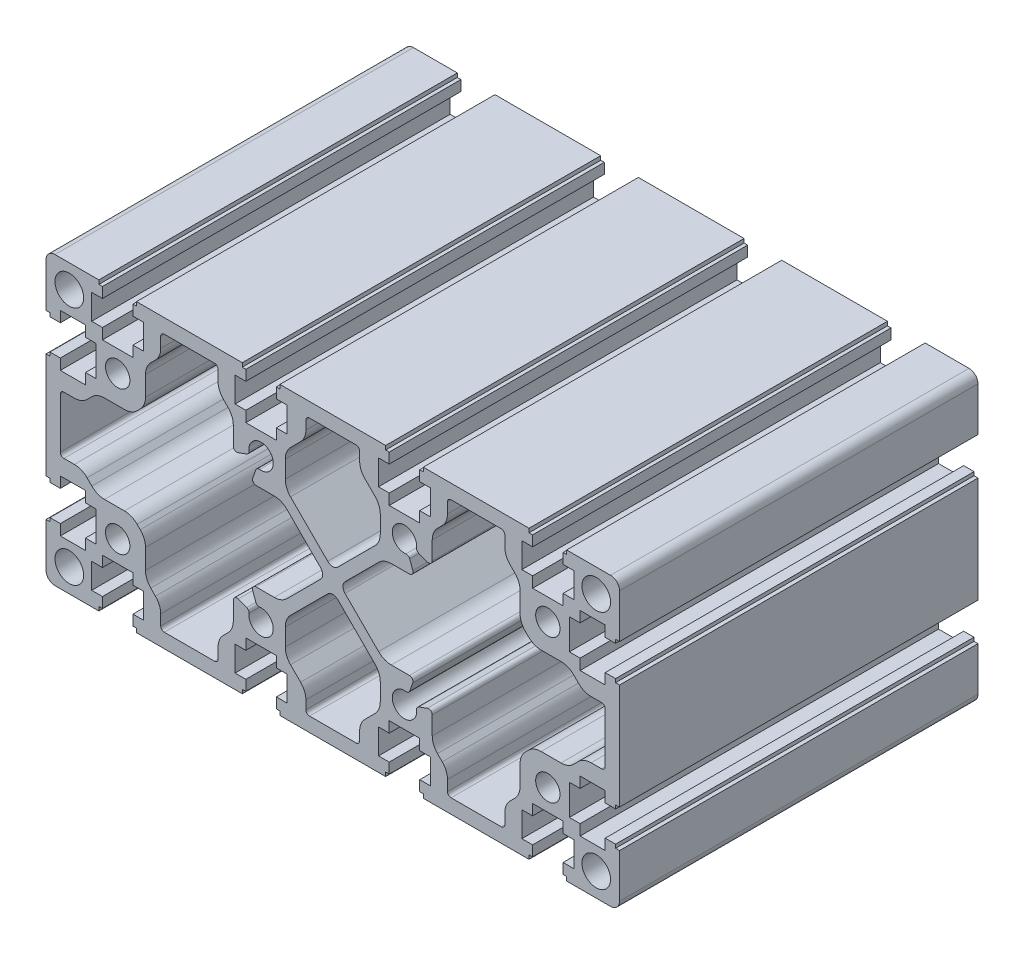
from build123d import *

# Parameters (mm, degrees)
SKETCH_1_R      = 4.000000341
SKETCH_1_R_2    = 3.400000291
EXTRUDE_1_DEPTH = 100


with BuildPart() as part:
    # 草图1 → 凸台-拉伸1 (new body)
    with BuildSketch(Plane.XY):
        with BuildLine():
            Line((137.500011689, 60.0000051), (125.250010647, 60.0000051))
            Line((125.250010647, 60.0000051), (125.250010647, 58.900005007))
            Line((125.250010647, 58.900005007), (124.25001056, 58.900005007))
            Line((124.25001056, 58.900005007), (124.25001056, 56.000004759))
            Line((124.25001056, 56.000004759), (127.250010815, 56.000004759))
            Line((127.250010815, 56.000004759), (127.250010815, 49.000004164))
            Line((127.250010815, 49.000004164), (124.25001056, 49.000004164))
            Line((124.25001056, 49.000004164), (124.25001056, 46.000003909))
            Line((124.25001056, 46.000003909), (115.75000984, 46.000003909))
            Line((115.75000984, 46.000003909), (115.75000984, 49.000004164))
            Line((115.75000984, 49.000004164), (112.750009585, 49.000004164))
            Line((112.750009585, 49.000004164), (112.750009585, 56.000004759))
            Line((112.750009585, 56.000004759), (115.75000984, 56.000004759))
            Line((115.75000984, 56.000004759), (115.75000984, 58.900005007))
            Line((115.75000984, 58.900005007), (114.750009753, 58.900005007))
            Line((114.750009753, 58.900005007), (114.750009753, 60.0000051))
            Line((114.750009753, 60.0000051), (85.250007247, 60.0000051))
            Line((85.250007247, 60.0000051), (85.250007247, 58.900005007))
            Line((85.250007247, 58.900005007), (84.25000716, 58.900005007))
            Line((84.25000716, 58.900005007), (84.25000716, 56.000004759))
            Line((84.25000716, 56.000004759), (87.250007415, 56.000004759))
            Line((87.250007415, 56.000004759), (87.250007415, 49.000004164))
            Line((87.250007415, 49.000004164), (84.25000716, 49.000004164))
            Line((84.25000716, 49.000004164), (84.25000716, 46.000003909))
            Line((84.25000716, 46.000003909), (75.75000644, 46.000003909))
            Line((75.75000644, 46.000003909), (75.75000644, 49.000004164))
            Line((75.75000644, 49.000004164), (72.750006185, 49.000004164))
            Line((72.750006185, 49.000004164), (72.750006185, 56.000004759))
            Line((72.750006185, 56.000004759), (75.75000644, 56.000004759))
            Line((75.75000644, 56.000004759), (75.75000644, 58.900005007))
            Line((75.75000644, 58.900005007), (74.750006353, 58.900005007))
            Line((74.750006353, 58.900005007), (74.750006353, 60.0000051))
            Line((74.750006353, 60.0000051), (45.250003847, 60.0000051))
            Line((45.250003847, 60.0000051), (45.250003847, 58.900005007))
            Line((45.250003847, 58.900005007), (44.25000376, 58.900005007))
            Line((44.25000376, 58.900005007), (44.25000376, 56.000004759))
            Line((44.25000376, 56.000004759), (47.250004015, 56.000004759))
            Line((47.250004015, 56.000004759), (47.250004015, 49.000004164))
            Line((47.250004015, 49.000004164), (44.25000376, 49.000004164))
            Line((44.25000376, 49.000004164), (44.25000376, 46.000003909))
            Line((44.25000376, 46.000003909), (35.75000304, 46.000003909))
            Line((35.75000304, 46.000003909), (35.75000304, 49.000004164))
            Line((35.75000304, 49.000004164), (32.750002785, 49.000004164))
            Line((32.750002785, 49.000004164), (32.750002785, 56.000004759))
            Line((32.750002785, 56.000004759), (35.75000304, 56.000004759))
            Line((35.75000304, 56.000004759), (35.75000304, 58.900005007))
            Line((35.75000304, 58.900005007), (34.750002953, 58.900005007))
            Line((34.750002953, 58.900005007), (34.750002953, 60.0000051))
            Line((34.750002953, 60.0000051), (5.250000447, 60.0000051))
            Line((5.250000447, 60.0000051), (5.250000447, 58.900005007))
            Line((5.250000447, 58.900005007), (4.25000036, 58.900005007))
            Line((4.25000036, 58.900005007), (4.25000036, 56.000004759))
            Line((4.25000036, 56.000004759), (7.250000615, 56.000004759))
            Line((7.250000615, 56.000004759), (7.250000615, 49.000004164))
            Line((7.250000615, 49.000004164), (4.25000036, 49.000004164))
            Line((4.25000036, 49.000004164), (4.25000036, 46.000003909))
            Line((4.25000036, 46.000003909), (-4.25000036, 46.000003909))
            Line((-4.25000036, 46.000003909), (-4.25000036, 49.000004164))
            Line((-4.25000036, 49.000004164), (-7.250000615, 49.000004164))
            Line((-7.250000615, 49.000004164), (-7.250000615, 56.000004759))
            Line((-7.250000615, 56.000004759), (-4.25000036, 56.000004759))
            Line((-4.25000036, 56.000004759), (-4.25000036, 58.900005007))
            Line((-4.25000036, 58.900005007), (-5.250000447, 58.900005007))
            Line((-5.250000447, 58.900005007), (-5.250000447, 60.0000051))
            Line((-5.250000447, 60.0000051), (-17.500001489, 60.0000051))
            ThreePointArc((-17.500001489, 60.0000051), (-19.267768591, 59.267771991), (-20.0000017, 57.500004889))
            Line((-20.0000017, 57.500004889), (-20.0000017, 45.250003847))
            Line((-20.0000017, 45.250003847), (-18.900001607, 45.250003847))
            Line((-18.900001607, 45.250003847), (-18.900001607, 44.25000376))
            Line((-18.900001607, 44.25000376), (-16.000001359, 44.25000376))
            Line((-16.000001359, 44.25000376), (-16.000001359, 47.250004015))
            Line((-16.000001359, 47.250004015), (-9.000000763, 47.250004015))
            Line((-9.000000763, 47.250004015), (-9.000000763, 44.25000376))
            Line((-9.000000763, 44.25000376), (-6.000000509, 44.25000376))
            Line((-6.000000509, 44.25000376), (-6.000000509, 35.75000304))
            Line((-6.000000509, 35.75000304), (-9.000000763, 35.75000304))
            Line((-9.000000763, 35.75000304), (-9.000000763, 32.750002785))
            Line((-9.000000763, 32.750002785), (-16.000001359, 32.750002785))
            Line((-16.000001359, 32.750002785), (-16.000001359, 35.75000304))
            Line((-16.000001359, 35.75000304), (-18.900001607, 35.75000304))
            Line((-18.900001607, 35.75000304), (-18.900001607, 34.750002953))
            Line((-18.900001607, 34.750002953), (-20.0000017, 34.750002953))
            Line((-20.0000017, 34.750002953), (-20.0000017, 5.250000447))
            Line((-20.0000017, 5.250000447), (-18.900001607, 5.250000447))
            Line((-18.900001607, 5.250000447), (-18.900001607, 4.25000036))
            Line((-18.900001607, 4.25000036), (-16.000001359, 4.25000036))
            Line((-16.000001359, 4.25000036), (-16.000001359, 7.250000615))
            Line((-16.000001359, 7.250000615), (-9.000000763, 7.250000615))
            Line((-9.000000763, 7.250000615), (-9.000000763, 4.25000036))
            Line((-9.000000763, 4.25000036), (-6.000000509, 4.25000036))
            Line((-6.000000509, 4.25000036), (-6.000000509, -4.25000036))
            Line((-6.000000509, -4.25000036), (-9.000000763, -4.25000036))
            Line((-9.000000763, -4.25000036), (-9.000000763, -7.25000062))
            Line((-9.000000763, -7.25000062), (-16.000001359, -7.25000062))
            Line((-16.000001359, -7.25000062), (-16.000001359, -4.25000036))
            Line((-16.000001359, -4.25000036), (-18.900001607, -4.25000036))
            Line((-18.900001607, -4.25000036), (-18.900001607, -5.250000447))
            Line((-18.900001607, -5.250000447), (-20.0000017, -5.250000447))
            Line((-20.0000017, -5.250000447), (-20.0000017, -17.500001489))
            ThreePointArc((-20.0000017, -17.500001489), (-19.267768591, -19.267768591), (-17.500001489, -20.0000017))
            Line((-17.500001489, -20.0000017), (-5.250000447, -20.0000017))
            Line((-5.250000447, -20.0000017), (-5.250000447, -18.900001607))
            Line((-5.250000447, -18.900001607), (-4.25000036, -18.900001607))
            Line((-4.25000036, -18.900001607), (-4.25000036, -16.000001359))
            Line((-4.25000036, -16.000001359), (-7.250000615, -16.000001359))
            Line((-7.250000615, -16.000001359), (-7.250000615, -9.000000763))
            Line((-7.250000615, -9.000000763), (-4.25000036, -9.000000763))
            Line((-4.25000036, -9.000000763), (-4.25000036, -6.000000509))
            Line((-4.25000036, -6.000000509), (4.25000036, -6.000000509))
            Line((4.25000036, -6.000000509), (4.25000036, -9.000000763))
            Line((4.25000036, -9.000000763), (7.250000615, -9.000000763))
            Line((7.250000615, -9.000000763), (7.250000615, -16.000001359))
            Line((7.250000615, -16.000001359), (4.25000036, -16.000001359))
            Line((4.25000036, -16.000001359), (4.25000036, -18.900001607))
            Line((4.25000036, -18.900001607), (5.250000447, -18.900001607))
            Line((5.250000447, -18.900001607), (5.250000447, -20.0000017))
            Line((5.250000447, -20.0000017), (34.750002953, -20.0000017))
            Line((34.750002953, -20.0000017), (34.750002953, -18.900001607))
            Line((34.750002953, -18.900001607), (35.75000304, -18.900001607))
            Line((35.75000304, -18.900001607), (35.75000304, -16.000001359))
            Line((35.75000304, -16.000001359), (32.750002785, -16.000001359))
            Line((32.750002785, -16.000001359), (32.750002785, -9.000000763))
            Line((32.750002785, -9.000000763), (35.75000304, -9.000000763))
            Line((35.75000304, -9.000000763), (35.75000304, -6.000000509))
            Line((35.75000304, -6.000000509), (44.25000376, -6.000000509))
            Line((44.25000376, -6.000000509), (44.25000376, -9.000000763))
            Line((44.25000376, -9.000000763), (47.250004015, -9.000000763))
            Line((47.250004015, -9.000000763), (47.250004015, -16.000001359))
            Line((47.250004015, -16.000001359), (44.25000376, -16.000001359))
            Line((44.25000376, -16.000001359), (44.25000376, -18.900001607))
            Line((44.25000376, -18.900001607), (45.250003847, -18.900001607))
            Line((45.250003847, -18.900001607), (45.250003847, -20.0000017))
            Line((45.250003847, -20.0000017), (74.750006353, -20.0000017))
            Line((74.750006353, -20.0000017), (74.750006353, -18.900001607))
            Line((74.750006353, -18.900001607), (75.75000644, -18.900001607))
            Line((75.75000644, -18.900001607), (75.75000644, -16.000001359))
            Line((75.75000644, -16.000001359), (72.750006185, -16.000001359))
            Line((72.750006185, -16.000001359), (72.750006185, -9.000000763))
            Line((72.750006185, -9.000000763), (75.75000644, -9.000000763))
            Line((75.75000644, -9.000000763), (75.75000644, -6.000000509))
            Line((75.75000644, -6.000000509), (84.25000716, -6.000000509))
            Line((84.25000716, -6.000000509), (84.25000716, -9.000000763))
            Line((84.25000716, -9.000000763), (87.250007415, -9.000000763))
            Line((87.250007415, -9.000000763), (87.250007415, -16.000001359))
            Line((87.250007415, -16.000001359), (84.25000716, -16.000001359))
            Line((84.25000716, -16.000001359), (84.25000716, -18.900001607))
            Line((84.25000716, -18.900001607), (85.250007247, -18.900001607))
            Line((85.250007247, -18.900001607), (85.250007247, -20.0000017))
            Line((85.250007247, -20.0000017), (114.750009753, -20.0000017))
            Line((114.750009753, -20.0000017), (114.750009753, -18.900001607))
            Line((114.750009753, -18.900001607), (115.75000984, -18.900001607))
            Line((115.75000984, -18.900001607), (115.75000984, -16.000001359))
            Line((115.75000984, -16.000001359), (112.750009585, -16.000001359))
            Line((112.750009585, -16.000001359), (112.750009585, -9.000000763))
            Line((112.750009585, -9.000000763), (115.75000984, -9.000000763))
            Line((115.75000984, -9.000000763), (115.75000984, -6.000000509))
            Line((115.75000984, -6.000000509), (124.25001056, -6.000000509))
            Line((124.25001056, -6.000000509), (124.25001056, -9.000000763))
            Line((124.25001056, -9.000000763), (127.250010815, -9.000000763))
            Line((127.250010815, -9.000000763), (127.250010815, -16.000001359))
            Line((127.250010815, -16.000001359), (124.25001056, -16.000001359))
            Line((124.25001056, -16.000001359), (124.25001056, -18.900001607))
            Line((124.25001056, -18.900001607), (125.250010647, -18.900001607))
            Line((125.250010647, -18.900001607), (125.250010647, -20.0000017))
            Line((125.250010647, -20.0000017), (137.500011689, -20.0000017))
            ThreePointArc((137.500011689, -20.0000017), (139.267778791, -19.267768591), (140.0000119, -17.500001489))
            Line((140.0000119, -17.500001489), (140.0000119, -5.250000447))
            Line((140.0000119, -5.250000447), (138.900011807, -5.250000447))
            Line((138.900011807, -5.250000447), (138.900011807, -4.25000036))
            Line((138.900011807, -4.25000036), (136.000011559, -4.25000036))
            Line((136.000011559, -4.25000036), (136.000011559, -7.25000062))
            Line((136.000011559, -7.25000062), (129.000010964, -7.25000062))
            Line((129.000010964, -7.25000062), (129.000010964, -4.25000036))
            Line((129.000010964, -4.25000036), (126.000010709, -4.25000036))
            Line((126.000010709, -4.25000036), (126.000010709, 4.25000036))
            Line((126.000010709, 4.25000036), (129.000010964, 4.25000036))
            Line((129.000010964, 4.25000036), (129.000010964, 7.250000615))
            Line((129.000010964, 7.250000615), (136.000011559, 7.250000615))
            Line((136.000011559, 7.250000615), (136.000011559, 4.25000036))
            Line((136.000011559, 4.25000036), (138.900011807, 4.25000036))
            Line((138.900011807, 4.25000036), (138.900011807, 5.250000447))
            Line((138.900011807, 5.250000447), (140.0000119, 5.250000447))
            Line((140.0000119, 5.250000447), (140.0000119, 34.750002953))
            Line((140.0000119, 34.750002953), (138.900011807, 34.750002953))
            Line((138.900011807, 34.750002953), (138.900011807, 35.75000304))
            Line((138.900011807, 35.75000304), (136.000011559, 35.75000304))
            Line((136.000011559, 35.75000304), (136.000011559, 32.750002785))
            Line((136.000011559, 32.750002785), (129.000010964, 32.750002785))
            Line((129.000010964, 32.750002785), (129.000010964, 35.75000304))
            Line((129.000010964, 35.75000304), (126.000010709, 35.75000304))
            Line((126.000010709, 35.75000304), (126.000010709, 44.25000376))
            Line((126.000010709, 44.25000376), (129.000010964, 44.25000376))
            Line((129.000010964, 44.25000376), (129.000010964, 47.250004015))
            Line((129.000010964, 47.250004015), (136.000011559, 47.250004015))
            Line((136.000011559, 47.250004015), (136.000011559, 44.25000376))
            Line((136.000011559, 44.25000376), (138.900011807, 44.25000376))
            Line((138.900011807, 44.25000376), (138.900011807, 45.250003847))
            Line((138.900011807, 45.250003847), (140.0000119, 45.250003847))
            Line((140.0000119, 45.250003847), (140.0000119, 57.500004889))
            ThreePointArc((140.0000119, 57.500004889), (139.267778791, 59.267771991), (137.500011689, 60.0000051))
        make_face()
        with Locations((-13.500001148, -13.500001148)):
            Circle(SKETCH_1_R, mode=Mode.SUBTRACT)
        Circle(SKETCH_1_R_2, mode=Mode.SUBTRACT)
        with Locations((-13.500001148, 53.500004548)):
            Circle(SKETCH_1_R, mode=Mode.SUBTRACT)
        with Locations((0, 40.0000034)):
            Circle(SKETCH_1_R_2, mode=Mode.SUBTRACT)
        with Locations((133.500011348, -13.500001148)):
            Circle(SKETCH_1_R, mode=Mode.SUBTRACT)
        with Locations((120.0000102, 0)):
            Circle(SKETCH_1_R_2, mode=Mode.SUBTRACT)
        with Locations((133.500011348, 53.500004548)):
            Circle(SKETCH_1_R, mode=Mode.SUBTRACT)
        with Locations((120.0000102, 40.0000034)):
            Circle(SKETCH_1_R_2, mode=Mode.SUBTRACT)
        with BuildLine():
            Line((37.66768927, 33.592022997), (38.53449585, 35.973554499))
            ThreePointArc((38.53449585, 35.973554499), (38.950674221, 36.483551297), (39.593691926, 36.624368206))
            ThreePointArc((39.593691926, 36.624368206), (42.404166664, 42.404166659), (36.624368208, 39.593691927))
            ThreePointArc((36.624368208, 39.593691927), (36.483551297, 38.950674222), (35.973554499, 38.534495848))
            Line((35.973554499, 38.534495848), (33.592022997, 37.66768927))
            ThreePointArc((33.592022997, 37.66768927), (32.676426339, 37.788229856), (32.250002742, 38.607381972))
            Line((32.250002742, 38.607381972), (32.250002742, 43.678935898))
            ThreePointArc((32.250002742, 43.678935898), (31.869400372, 45.592353223), (30.785536525, 47.214470108))
            Line((30.785536525, 47.214470108), (29.464468596, 48.535538029))
            ThreePointArc((29.464468596, 48.535538029), (28.380604747, 50.157654912), (28.000002377, 52.071072237))
            Line((28.000002377, 52.071072237), (28.000002382, 55.000004672))
            ThreePointArc((28.000002382, 55.000004672), (27.707109138, 55.707111515), (27.000002296, 56.000004759))
            Line((27.000002296, 56.000004759), (13.000001105, 56.000004759))
            ThreePointArc((13.000001105, 56.000004759), (12.292894262, 55.707111515), (12.000001018, 55.000004672))
            Line((12.000001018, 55.000004672), (12.000001023, 52.071072237))
            ThreePointArc((12.000001023, 52.071072237), (11.619398653, 50.157654912), (10.5355348, 48.535538032))
            Line((10.5355348, 48.535538032), (9.214466877, 47.214470106))
            ThreePointArc((9.214466877, 47.214470106), (8.130603028, 45.592353223), (7.750000658, 43.678935898))
            Line((7.750000658, 43.678935898), (7.750000663, 38.121071052))
            ThreePointArc((7.750000663, 38.121071052), (7.369398293, 36.207653727), (6.28553444, 34.585536847))
            Line((6.28553444, 34.585536847), (5.414466556, 33.714468956))
            ThreePointArc((5.414466556, 33.714468956), (3.792349674, 32.630605107), (1.878932348, 32.250002742))
            Line((1.878932348, 32.250002742), (-3.678932503, 32.250002742))
            ThreePointArc((-3.678932503, 32.250002742), (-5.592349828, 31.869400372), (-7.214466708, 30.785536519))
            Line((-7.214466708, 30.785536519), (-8.535534629, 29.464468596))
            ThreePointArc((-8.535534629, 29.464468596), (-10.157651512, 28.380604747), (-12.071068837, 28.000002377))
            Line((-12.071068837, 28.000002377), (-15.000001278, 28.000002382))
            ThreePointArc((-15.000001278, 28.000002382), (-15.707108119, 27.707109139), (-16.000001359, 27.000002296))
            Line((-16.000001359, 27.000002296), (-16.000001364, 13.000001105))
            ThreePointArc((-16.000001364, 13.000001105), (-15.70710812, 12.292894262), (-15.000001278, 12.000001018))
            Line((-15.000001278, 12.000001018), (-12.071068837, 12.000001023))
            ThreePointArc((-12.071068837, 12.000001023), (-10.157651512, 11.619398653), (-8.535534632, 10.5355348))
            Line((-8.535534632, 10.5355348), (-7.214466711, 9.214466877))
            ThreePointArc((-7.214466711, 9.214466877), (-5.592349828, 8.130603028), (-3.678932503, 7.750000658))
            Line((-3.678932503, 7.750000658), (1.878932348, 7.750000658))
            ThreePointArc((1.878932348, 7.750000658), (3.792349672, 7.369398289), (5.414466553, 6.28553444))
            Line((5.414466553, 6.28553444), (6.285534444, 5.414466556))
            ThreePointArc((6.285534444, 5.414466556), (7.369398293, 3.792349674), (7.750000658, 1.878932348))
            Line((7.750000658, 1.878932348), (7.750000658, -3.678932503))
            ThreePointArc((7.750000658, -3.678932503), (8.130603027, -5.592349826), (9.214466876, -7.214466708))
            Line((9.214466876, -7.214466708), (10.535534804, -8.535534629))
            ThreePointArc((10.535534804, -8.535534629), (11.619398653, -10.157651511), (12.000001018, -12.071068837))
            Line((12.000001018, -12.071068837), (12.000001018, -15.000001278))
            ThreePointArc((12.000001018, -15.000001278), (12.292894261, -15.707108119), (13.000001105, -16.000001359))
            Line((13.000001105, -16.000001359), (27.000002296, -16.000001364))
            ThreePointArc((27.000002296, -16.000001364), (27.707109137, -15.707108121), (28.000002377, -15.000001278))
            Line((28.000002377, -15.000001278), (28.000002377, -12.071068837))
            ThreePointArc((28.000002377, -12.071068837), (28.380604747, -10.157651512), (29.4644686, -8.535534632))
            Line((29.4644686, -8.535534632), (30.785536523, -7.214466711))
            ThreePointArc((30.785536523, -7.214466711), (31.869400372, -5.592349828), (32.250002742, -3.678932503))
            Line((32.250002742, -3.678932503), (32.250002737, 1.392621428))
            ThreePointArc((32.250002737, 1.392621428), (32.676426338, 2.211773543), (33.592022997, 2.332314126))
            Line((33.592022997, 2.332314126), (35.973554499, 1.46550755))
            ThreePointArc((35.973554499, 1.46550755), (36.483551297, 1.049329179), (36.624368206, 0.406311474))
            ThreePointArc((36.624368206, 0.406311474), (42.404166654, -2.404163269), (39.593691927, 3.375635187))
            ThreePointArc((39.593691927, 3.375635187), (38.95067422, 3.516452099), (38.534495848, 4.026448901))
            Line((38.534495848, 4.026448901), (37.66768927, 6.407980398))
            ThreePointArc((37.66768927, 6.407980398), (37.788229857, 7.323577057), (38.607381972, 7.750000658))
            Line((38.607381972, 7.750000658), (43.678935898, 7.750000658))
            ThreePointArc((43.678935898, 7.750000658), (45.592353223, 8.130603028), (47.214470108, 9.214466876))
            Line((47.214470108, 9.214466876), (56.585791243, 18.585788019))
            ThreePointArc((56.585791243, 18.585788019), (57.17157773, 20.000001699), (56.585791247, 21.41421538))
            Line((56.585791247, 21.41421538), (47.214470106, 30.785536523))
            ThreePointArc((47.214470106, 30.785536523), (45.592353223, 31.869400372), (43.678935898, 32.250002742))
            Line((43.678935898, 32.250002742), (38.607381972, 32.250002737))
            ThreePointArc((38.607381972, 32.250002737), (37.788229857, 32.676426338), (37.66768927, 33.592022997))
        make_face(mode=Mode.SUBTRACT)
        with BuildLine():
            Line((67.500005739, -15.000001278), (67.500005739, -12.596552281))
            ThreePointArc((67.500005739, -12.596552281), (67.880608104, -10.683134955), (68.964471953, -9.061018073))
            Line((68.964471953, -9.061018073), (71.785540006, -6.239950027))
            ThreePointArc((71.785540006, -6.239950027), (72.869403858, -4.617833144), (73.250006229, -2.704415817))
            Line((73.250006229, -2.704415817), (73.250006224, 2.153448972))
            ThreePointArc((73.250006224, 2.153448972), (72.869403859, 4.066866298), (71.785540009, 5.688983181))
            Line((71.785540009, 5.688983181), (61.41421878, 16.060304403))
            ThreePointArc((61.41421878, 16.060304403), (60.000005099, 16.646090886), (58.585791419, 16.060304399))
            Line((58.585791419, 16.060304399), (48.214470194, 5.688983177))
            ThreePointArc((48.214470194, 5.688983177), (47.130606341, 4.066866297), (46.750003971, 2.153448972))
            Line((46.750003971, 2.153448972), (46.750003971, -2.704415817))
            ThreePointArc((46.750003971, -2.704415817), (47.130606341, -4.617833142), (48.214470191, -6.239950025))
            Line((48.214470191, -6.239950025), (51.035538244, -9.061018076))
            ThreePointArc((51.035538244, -9.061018076), (52.119402097, -10.683134956), (52.500004466, -12.596552281))
            Line((52.500004466, -12.596552281), (52.500004461, -15.000001278))
            ThreePointArc((52.500004461, -15.000001278), (52.792897705, -15.70710812), (53.500004548, -16.000001364))
            Line((53.500004548, -16.000001364), (66.500005652, -16.000001364))
            ThreePointArc((66.500005652, -16.000001364), (67.207112495, -15.70710812), (67.500005739, -15.000001278))
        make_face(mode=Mode.SUBTRACT)
        with BuildLine():
            Line((66.500005652, 56.000004759), (53.500004548, 56.000004759))
            ThreePointArc((53.500004548, 56.000004759), (52.792897705, 55.707111515), (52.500004461, 55.000004672))
            Line((52.500004461, 55.000004672), (52.500004461, 52.596555681))
            ThreePointArc((52.500004461, 52.596555681), (52.119402096, 50.683138355), (51.035538247, 49.061021473))
            Line((51.035538247, 49.061021473), (48.214470194, 46.239953422))
            ThreePointArc((48.214470194, 46.239953422), (47.130606341, 44.617836542), (46.750003971, 42.704419217))
            Line((46.750003971, 42.704419217), (46.750003971, 37.846554428))
            ThreePointArc((46.750003971, 37.846554428), (47.130606341, 35.933137102), (48.214470191, 34.311020219))
            Line((48.214470191, 34.311020219), (58.585791415, 23.939698997))
            ThreePointArc((58.585791415, 23.939698997), (60.000005098, 23.353912509), (61.414218781, 23.939698996))
            Line((61.414218781, 23.939698996), (71.785540006, 34.311020223))
            ThreePointArc((71.785540006, 34.311020223), (72.869403859, 35.933137103), (73.250006229, 37.846554428))
            Line((73.250006229, 37.846554428), (73.250006224, 42.704419217))
            ThreePointArc((73.250006224, 42.704419217), (72.869403859, 44.617836543), (71.785540009, 46.239953425))
            Line((71.785540009, 46.239953425), (68.964471956, 49.061021476))
            ThreePointArc((68.964471956, 49.061021476), (67.880608104, 50.683138356), (67.500005734, 52.596555681))
            Line((67.500005734, 52.596555681), (67.500005739, 55.000004672))
            ThreePointArc((67.500005739, 55.000004672), (67.207112495, 55.707111515), (66.500005652, 56.000004759))
        make_face(mode=Mode.SUBTRACT)
        with BuildLine():
            Line((86.407987198, 37.66768927), (84.026455701, 38.53449585))
            ThreePointArc((84.026455701, 38.53449585), (83.516458903, 38.950674221), (83.375641994, 39.593691926))
            ThreePointArc((83.375641994, 39.593691926), (77.595843541, 42.404166664), (80.406318273, 36.624368208))
            ThreePointArc((80.406318273, 36.624368208), (81.049335977, 36.483551298), (81.465514347, 35.973554499))
            Line((81.465514347, 35.973554499), (82.33232093, 33.592022997))
            ThreePointArc((82.33232093, 33.592022997), (82.211780344, 32.676426339), (81.392628228, 32.250002742))
            Line((81.392628228, 32.250002742), (76.321074297, 32.250002742))
            ThreePointArc((76.321074297, 32.250002742), (74.407656972, 31.869400372), (72.785540093, 30.785536519))
            Line((72.785540093, 30.785536519), (63.414218952, 21.414215381))
            ThreePointArc((63.414218952, 21.414215381), (62.828432465, 20.000001698), (63.414218953, 18.585788015))
            Line((63.414218953, 18.585788015), (72.785540089, 9.214466877))
            ThreePointArc((72.785540089, 9.214466877), (74.407656972, 8.130603028), (76.321074297, 7.750000658))
            Line((76.321074297, 7.750000658), (81.392628228, 7.750000658))
            ThreePointArc((81.392628228, 7.750000658), (82.211780343, 7.323577057), (82.332320927, 6.407980398))
            Line((82.332320927, 6.407980398), (81.46551435, 4.026448896))
            ThreePointArc((81.46551435, 4.026448896), (81.049335979, 3.516452099), (80.406318274, 3.375635194))
            ThreePointArc((80.406318274, 3.375635194), (77.595843536, -2.404163259), (83.375641993, 0.406311473))
            ThreePointArc((83.375641993, 0.406311473), (83.516458902, 1.049329177), (84.026455701, 1.465507547))
            Line((84.026455701, 1.465507547), (86.407987198, 2.33231413))
            ThreePointArc((86.407987198, 2.33231413), (87.323583857, 2.211773543), (87.750007458, 1.392621428))
            Line((87.750007458, 1.392621428), (87.750007458, -3.678932503))
            ThreePointArc((87.750007458, -3.678932503), (88.130609827, -5.592349826), (89.214473676, -7.214466708))
            Line((89.214473676, -7.214466708), (90.535541604, -8.535534629))
            ThreePointArc((90.535541604, -8.535534629), (91.619405453, -10.157651511), (92.000007818, -12.071068837))
            Line((92.000007818, -12.071068837), (92.000007818, -15.000001278))
            ThreePointArc((92.000007818, -15.000001278), (92.292901061, -15.707108119), (93.000007905, -16.000001359))
            Line((93.000007905, -16.000001359), (107.000009096, -16.000001364))
            ThreePointArc((107.000009096, -16.000001364), (107.707115938, -15.70710812), (108.000009182, -15.000001278))
            Line((108.000009182, -15.000001278), (108.000009177, -12.071068837))
            ThreePointArc((108.000009177, -12.071068837), (108.380611547, -10.157651512), (109.4644754, -8.535534632))
            Line((109.4644754, -8.535534632), (110.785543323, -7.214466711))
            ThreePointArc((110.785543323, -7.214466711), (111.869407172, -5.592349828), (112.250009542, -3.678932503))
            Line((112.250009542, -3.678932503), (112.250009537, 1.878932348))
            ThreePointArc((112.250009537, 1.878932348), (112.630611907, 3.792349673), (113.71447576, 5.414466553))
            Line((113.71447576, 5.414466553), (114.585543644, 6.285534439))
            ThreePointArc((114.585543644, 6.285534439), (116.207660527, 7.369398288), (118.121077852, 7.750000658))
            Line((118.121077852, 7.750000658), (123.678942703, 7.750000658))
            ThreePointArc((123.678942703, 7.750000658), (125.592360026, 8.130603027), (127.214476908, 9.214466876))
            Line((127.214476908, 9.214466876), (128.535544829, 10.535534804))
            ThreePointArc((128.535544829, 10.535534804), (130.157661711, 11.619398653), (132.071079037, 12.000001018))
            Line((132.071079037, 12.000001018), (135.000011473, 12.000001018))
            ThreePointArc((135.000011473, 12.000001018), (135.707118315, 12.292894262), (136.000011559, 13.000001105))
            Line((136.000011559, 13.000001105), (136.000011559, 27.000002296))
            ThreePointArc((136.000011559, 27.000002296), (135.707118316, 27.707109137), (135.000011473, 28.000002377))
            Line((135.000011473, 28.000002377), (132.071079037, 28.000002377))
            ThreePointArc((132.071079037, 28.000002377), (130.157661712, 28.380604747), (128.535544832, 29.4644686))
            Line((128.535544832, 29.4644686), (127.214476911, 30.785536523))
            ThreePointArc((127.214476911, 30.785536523), (125.592360028, 31.869400372), (123.678942703, 32.250002742))
            Line((123.678942703, 32.250002742), (118.121077852, 32.250002737))
            ThreePointArc((118.121077852, 32.250002737), (116.207660527, 32.630605107), (114.585543647, 33.71446896))
            Line((114.585543647, 33.71446896), (113.714475756, 34.585536844))
            ThreePointArc((113.714475756, 34.585536844), (112.630611907, 36.207653726), (112.250009542, 38.121071052))
            Line((112.250009542, 38.121071052), (112.250009542, 43.678935898))
            ThreePointArc((112.250009542, 43.678935898), (111.869407172, 45.592353223), (110.785543325, 47.214470108))
            Line((110.785543325, 47.214470108), (109.464475396, 48.535538029))
            ThreePointArc((109.464475396, 48.535538029), (108.380611547, 50.157654911), (108.000009182, 52.071072237))
            Line((108.000009182, 52.071072237), (108.000009182, 55.000004672))
            ThreePointArc((108.000009182, 55.000004672), (107.707115938, 55.707111515), (107.000009096, 56.000004759))
            Line((107.000009096, 56.000004759), (93.000007905, 56.000004759))
            ThreePointArc((93.000007905, 56.000004759), (92.292901062, 55.707111515), (92.000007818, 55.000004672))
            Line((92.000007818, 55.000004672), (92.000007823, 52.071072237))
            ThreePointArc((92.000007823, 52.071072237), (91.619405453, 50.157654912), (90.5355416, 48.535538032))
            Line((90.5355416, 48.535538032), (89.214473677, 47.214470106))
            ThreePointArc((89.214473677, 47.214470106), (88.130609828, 45.592353223), (87.750007458, 43.678935898))
            Line((87.750007458, 43.678935898), (87.750007458, 38.607381972))
            ThreePointArc((87.750007458, 38.607381972), (87.323583857, 37.788229857), (86.407987198, 37.66768927))
        make_face(mode=Mode.SUBTRACT)
    extrude(amount=EXTRUDE_1_DEPTH)


solid = part.part
